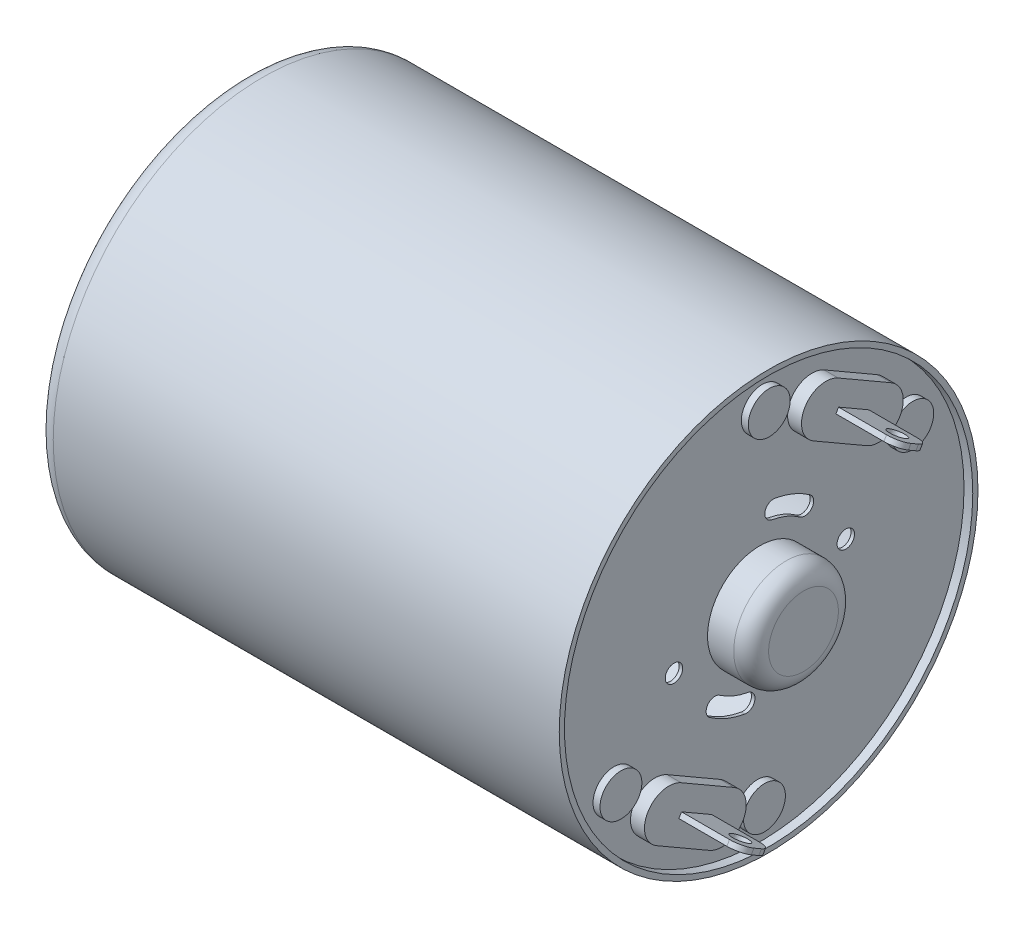
from build123d import *

# Parameters (mm, degrees)
SKETCH1_R                = 12
SKETCH1_R_2              = 11.7
BOSS_EXTRUDE1_DEPTH      = 30
SKETCH2_R                = 11.7
BOSS_EXTRUDE2_DEPTH      = 0.2
SKETCH3_R                = 3
BOSS_EXTRUDE3_DEPTH      = 2.5
FILLET1_R                = 1
CUT_EXTRUDE1_DEPTH       = 35.03307215
CIRPATTERN1_COUNT        = 2
SKETCH5_R                = 0.5
CUT_EXTRUDE2_DEPTH       = 35.03307215
CIRPATTERN2_COUNT        = 2
BOSS_EXTRUDE4_START      = -0.3
SKETCH7_R                = 11.7
BOSS_EXTRUDE4_DEPTH      = 0.3
CUT_EXTRUDE3_REACH       = 38.222
SKETCH9_R                = 3
BOSS_EXTRUDE5_DEPTH      = 0.8
SKETCH10_R               = 1.2
BOSS_EXTRUDE6_DEPTH      = 0.4
BOSS_EXTRUDE7_DEPTH      = 3.5
SKETCH12_R               = 0.5
CUT_EXTRUDE4_DEPTH       = 40.452075937
FILLET3_R                = 0.75
CIRPATTERN3_COUNT        = 2
FILLET3_OF_CIRPATTERN3_R = 0.75
SKETCH13_R               = 3
BOSS_EXTRUDE8_DEPTH      = 0.3
SKETCH14_R               = 1
CUT_EXTRUDE5_DEPTH       = 0.3
FILLET2_R                = 1
CIRPATTERN4_COUNT        = 2


with BuildPart() as part:
    # Sketch1 → Boss-Extrude1 (new body)
    with BuildSketch(Plane(origin=(0, 0, 0), x_dir=(0, 0, -1), z_dir=(1, 0, 0))):
        Circle(SKETCH1_R)
        Circle(SKETCH1_R_2, mode=Mode.SUBTRACT)
    extrude(amount=-BOSS_EXTRUDE1_DEPTH)

    # Sketch2 → Boss-Extrude2 (add)
    with BuildSketch(Plane(origin=(-0.5, 0, 0), x_dir=(0, 0, -1), z_dir=(1, 0, 0))):
        Circle(SKETCH2_R)
    extrude(amount=-BOSS_EXTRUDE2_DEPTH)

    # Sketch3 → Boss-Extrude3 (add)
    with BuildSketch(Plane(origin=(-0.5, 0, 0), x_dir=(0, 0, -1), z_dir=(1, 0, 0))):
        Circle(SKETCH3_R)
    extrude(amount=BOSS_EXTRUDE3_DEPTH)

    # Fillet1
    fillet1_edges = [part.edges().sort_by_distance(p)[0] for p in [
        (2, 0, 3),
    ]]
    fillet(fillet1_edges, radius=FILLET1_R)

    # Sketch4 → Cut-Extrude1 (cut, through all)
    with BuildSketch(Plane(origin=(-0.5, 0, 0), x_dir=(0, 0, -1), z_dir=(1, 0, 0))):
        with BuildLine():
            ThreePointArc((2.867882182, 4.095760221), (1.913417162, 4.619397663), (0.868240888, 4.924038765))
            ThreePointArc((0.868240888, 4.924038765), (0.289012923, 4.518458977), (0.694592711, 3.939231012))
            ThreePointArc((0.694592711, 3.939231012), (1.530733729, 3.69551813), (2.294305745, 3.276608177))
            ThreePointArc((2.294305745, 3.276608177), (2.990669986, 3.399395981), (2.867882182, 4.095760221))
        make_face()
    cut_extrude1 = extrude(amount=-CUT_EXTRUDE1_DEPTH, mode=Mode.SUBTRACT)

    # CirPattern1: Cut-Extrude1 ×2 about axis
    cirpattern1_axis = Axis((0, 0, 0), (1, 0, 0))
    for i in range(1, CIRPATTERN1_COUNT):
        add(cut_extrude1.rotate(cirpattern1_axis, i * 360 / CIRPATTERN1_COUNT), mode=Mode.SUBTRACT)

    # Sketch5 → Cut-Extrude2 (cut, through all)
    with BuildSketch(Plane(origin=(-0.5, 0, 0), x_dir=(0, 0, -1), z_dir=(1, 0, 0))):
        with Locations((4.924038765, 0.868240888)):
            Circle(SKETCH5_R)
    cut_extrude2 = extrude(amount=-CUT_EXTRUDE2_DEPTH, mode=Mode.SUBTRACT)

    # CirPattern2: Cut-Extrude2 ×2 about axis
    cirpattern2_axis = Axis((0, 0, 0), (1, 0, 0))
    for i in range(1, CIRPATTERN2_COUNT):
        add(cut_extrude2.rotate(cirpattern2_axis, i * 360 / CIRPATTERN2_COUNT), mode=Mode.SUBTRACT)

    # Sketch7 → Boss-Extrude4 (add)
    with BuildSketch(Plane.ZY.offset(30).offset(BOSS_EXTRUDE4_START)):
        with Locations(Location((0, 0, 0), (0, 0, 180))):
            Circle(SKETCH7_R)
    extrude(amount=BOSS_EXTRUDE4_DEPTH)

    # Sketch9 → Cut-Extrude3 (cut, up to next)
    with BuildSketch(Plane.ZY.offset(30), mode=Mode.PRIVATE) as cut_extrude3_sk1:
        with Locations(Location((0, 0, 0), (0, 0, 180))):
            Circle(SKETCH9_R)
    cut_extrude3_tool1 = extrude(cut_extrude3_sk1.sketch, amount=-CUT_EXTRUDE3_REACH, mode=Mode.PRIVATE) & part.part
    add(cut_extrude3_tool1.solids().sort_by_distance((-30, 0, 0))[0], mode=Mode.SUBTRACT)

    # Sketch6 → Boss-Extrude5 (add)
    with BuildSketch(Plane(origin=(-0.5, 0, 0), x_dir=(0, 0, -1), z_dir=(1, 0, 0))):
        with BuildLine():
            Line((3.684455543, 9.881664199), (6.715544457, 8.131664199))
            ThreePointArc((6.715544457, 8.131664199), (7.227980022, 6.219228634), (5.315544457, 5.706793069))
            Line((5.315544457, 5.706793069), (2.284455543, 7.456793069))
            ThreePointArc((2.284455543, 7.456793069), (1.772019978, 9.369228634), (3.684455543, 9.881664199))
        make_face()
    boss_extrude5 = extrude(amount=BOSS_EXTRUDE5_DEPTH)

    # Sketch10 → Boss-Extrude6 (add)
    with BuildSketch(Plane(origin=(-0.5, 0, 0), x_dir=(0, 0, -1), z_dir=(1, 0, 0))):
        with Locations((0.136379332, 9.736215932)):
            Circle(SKETCH10_R)
        with Locations((8.363620668, 4.986215932)):
            Circle(SKETCH10_R)
    boss_extrude6 = extrude(amount=BOSS_EXTRUDE6_DEPTH)

    # Sketch11 → Boss-Extrude7 (add)
    with BuildSketch(Plane(origin=(0.3, 0, 0), x_dir=(0, 0, -1), z_dir=(1, 0, 0))):
        Polygon((3.708974596, 8.424132445), (5.441025404, 7.424132445), (5.291025404, 7.164324823), (3.558974596, 8.164324823), align=None)
    boss_extrude7 = extrude(amount=BOSS_EXTRUDE7_DEPTH)

    # Sketch12 → Cut-Extrude4 (cut, through all)
    with BuildSketch(Plane(origin=(0, 7.664324823, -4.425), x_dir=(-1, 0, 0), z_dir=(0, -0.86602540378444, 0.4999999999999975))):
        with Locations(Location((-2.8, 0, 0), (0, 0, 90))):
            Circle(SKETCH12_R)
    cut_extrude4 = extrude(amount=-CUT_EXTRUDE4_DEPTH, mode=Mode.SUBTRACT)

    # Fillet3
    fillet3_edges = [part.edges().sort_by_distance(p)[0] for p in [
        (3.8, 7.294228634, -5.366025404),
        (3.8, 8.294228634, -3.633974596),
    ]]
    fillet(fillet3_edges, radius=FILLET3_R)

    # CirPattern3: Boss-Extrude5, Boss-Extrude7, Cut-Extrude4 ×2 about axis
    cirpattern3_axis = Axis((0, 0, 0), (1, 0, 0))
    add([boss_extrude5.rotate(cirpattern3_axis, i * 360 / CIRPATTERN3_COUNT) for i in range(1, CIRPATTERN3_COUNT)])
    add([boss_extrude7.rotate(cirpattern3_axis, i * 360 / CIRPATTERN3_COUNT) for i in range(1, CIRPATTERN3_COUNT)])
    add([cut_extrude4.rotate(cirpattern3_axis, i * 360 / CIRPATTERN3_COUNT) for i in range(1, CIRPATTERN3_COUNT)], mode=Mode.SUBTRACT)

    # Fillet3 of CirPattern3
    fillet3_of_cirpattern3_edges = [part.edges().sort_by_distance(p)[0] for p in [
        (3.8, -7.294228634, 5.366025404),
        (3.8, -8.294228634, 3.633974596),
    ]]
    fillet(fillet3_of_cirpattern3_edges, radius=FILLET3_OF_CIRPATTERN3_R)

    # Fillet2
    fillet2_edges = [part.edges().sort_by_distance(p)[0] for p in [
        (-30, 0, 12),
    ]]
    fillet(fillet2_edges, radius=FILLET2_R)

    # CirPattern4: Boss-Extrude6 ×2 about axis
    cirpattern4_axis = Axis((0, 0, 0), (1, 0, 0))
    for i in range(1, CIRPATTERN4_COUNT):
        add(boss_extrude6.rotate(cirpattern4_axis, i * 360 / CIRPATTERN4_COUNT))


with BuildPart() as body_2:
    # Sketch13 → Boss-Extrude8 (new body)
    with BuildSketch(Plane.ZY.offset(30)):
        Circle(SKETCH13_R)
    extrude(amount=-BOSS_EXTRUDE8_DEPTH)

    # Sketch14 → Cut-Extrude5 (cut)
    with BuildSketch(Plane.ZY.offset(30)):
        Circle(SKETCH14_R)
    extrude(amount=-CUT_EXTRUDE5_DEPTH, mode=Mode.SUBTRACT)


solid = Compound([part.part, body_2.part])
